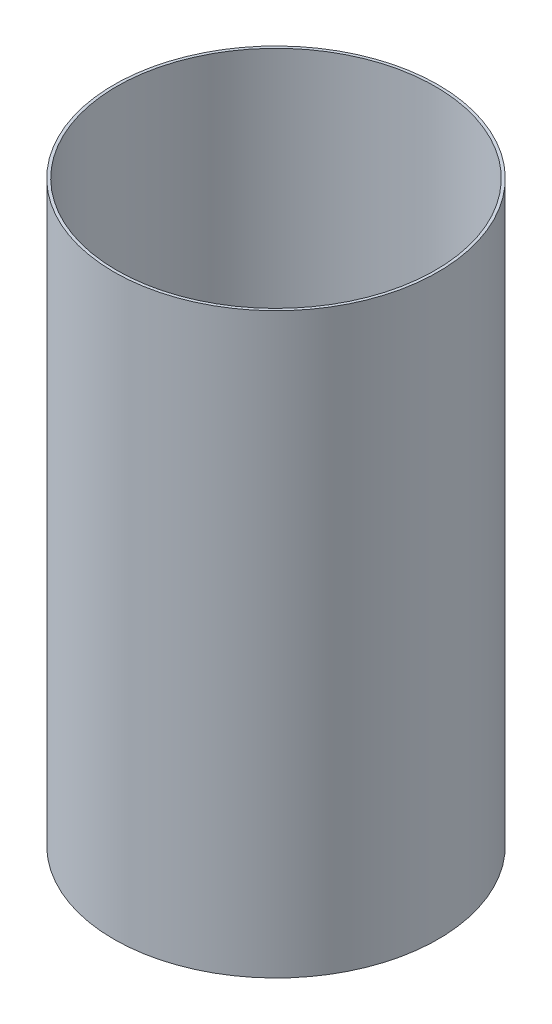
from build123d import *

# Parameters (mm, degrees)
SKETCH1_R           = 64.135
SKETCH1_R_2         = 63.0174
BOSS_EXTRUDE1_DEPTH = 228.6


with BuildPart() as part:
    # Sketch1 → Boss-Extrude1 (new body)
    with BuildSketch(Plane(origin=(0, 0, 0), x_dir=(1, 0, 0), z_dir=(0, 1, 0))):
        with Locations(Location((0, 0, 0), (0, 0, 270))):
            Circle(SKETCH1_R)
        with Locations(Location((0, 0, 0), (0, 0, 270))):
            Circle(SKETCH1_R_2, mode=Mode.SUBTRACT)
    extrude(amount=BOSS_EXTRUDE1_DEPTH)


solid = part.part
